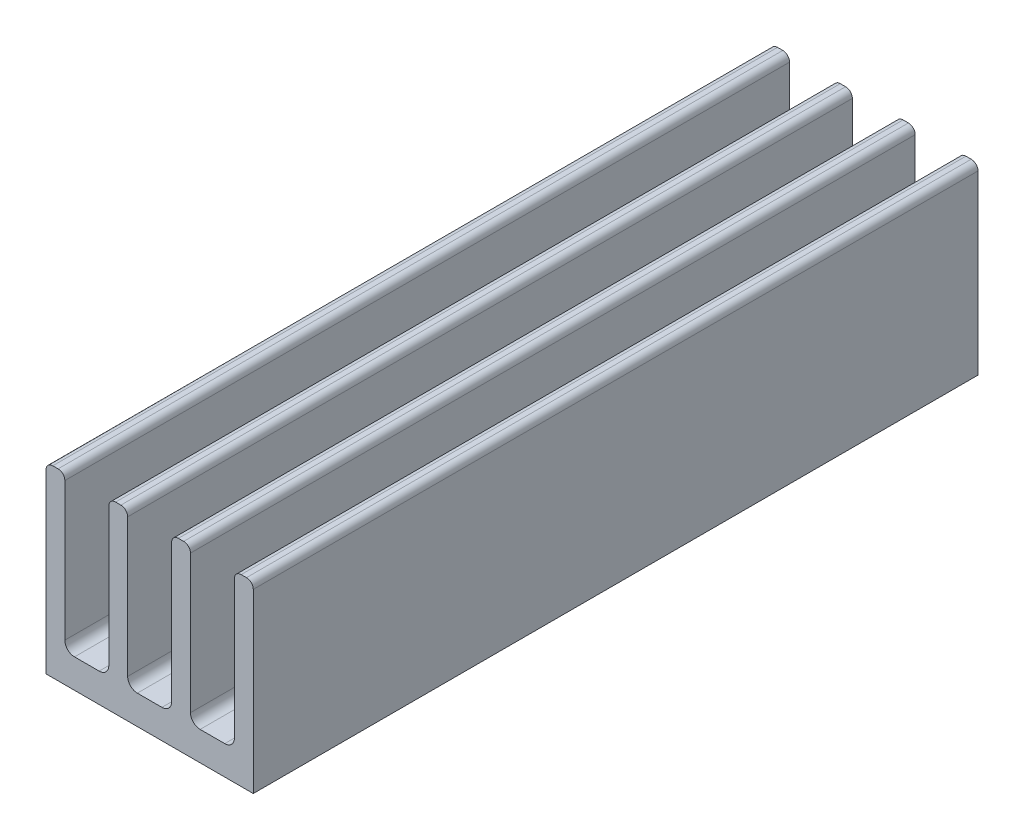
from build123d import *

# Parameters (mm, degrees)
BOSS_EXTRUDE1_DEPTH = 75


with BuildPart() as part:
    # Model → Boss-Extrude1 (new body)
    with BuildSketch(Plane.XY):
        with BuildLine():
            Line((12.048720141, 3), (10.773720141, 3))
            Line((10.773720141, 3), (9.498720141, 3))
            ThreePointArc((9.498720141, 3), (8.79161336, 3.292893219), (8.498720141, 4))
            Line((8.498720141, 4), (8.498720141, 18.3))
            ThreePointArc((8.498720141, 18.3), (8.293694888, 18.794974747), (7.798720141, 19))
            Line((7.798720141, 19), (7.248720141, 19))
            ThreePointArc((7.248720141, 19), (6.753745394, 18.794974747), (6.548720141, 18.3))
            Line((6.548720141, 18.3), (6.548720141, 4))
            ThreePointArc((6.548720141, 4), (6.255826922, 3.292893219), (5.548720141, 3))
            Line((5.548720141, 3), (2.998720141, 3))
            ThreePointArc((2.998720141, 3), (2.29161336, 3.292893219), (1.998720141, 4))
            Line((1.998720141, 4), (1.998720141, 18.3))
            ThreePointArc((1.998720141, 18.3), (1.793694888, 18.794974747), (1.298720141, 19))
            Line((1.298720141, 19), (0.748720141, 19))
            ThreePointArc((0.748720141, 19), (0.253745394, 18.794974747), (0.048720141, 18.3))
            Line((0.048720141, 18.3), (0.048720141, 0))
            Line((0.048720141, 0), (10.773720141, 0))
            Line((10.773720141, 0), (21.498720141, 0))
            Line((21.498720141, 0), (21.498720141, 18.3))
            ThreePointArc((21.498720141, 18.3), (21.293694888, 18.794974747), (20.798720141, 19))
            Line((20.798720141, 19), (20.248720141, 19))
            ThreePointArc((20.248720141, 19), (19.753745394, 18.794974747), (19.548720141, 18.3))
            Line((19.548720141, 18.3), (19.548720141, 4))
            ThreePointArc((19.548720141, 4), (19.255826922, 3.292893219), (18.548720141, 3))
            Line((18.548720141, 3), (15.998720141, 3))
            ThreePointArc((15.998720141, 3), (15.29161336, 3.292893219), (14.998720141, 4))
            Line((14.998720141, 4), (14.998720141, 18.3))
            ThreePointArc((14.998720141, 18.3), (14.793694888, 18.794974747), (14.298720141, 19))
            Line((14.298720141, 19), (13.748720141, 19))
            ThreePointArc((13.748720141, 19), (13.253745394, 18.794974747), (13.048720141, 18.3))
            Line((13.048720141, 18.3), (13.048720141, 4))
            ThreePointArc((13.048720141, 4), (12.755826922, 3.292893219), (12.048720141, 3))
        make_face()
    extrude(amount=BOSS_EXTRUDE1_DEPTH)


solid = part.part
